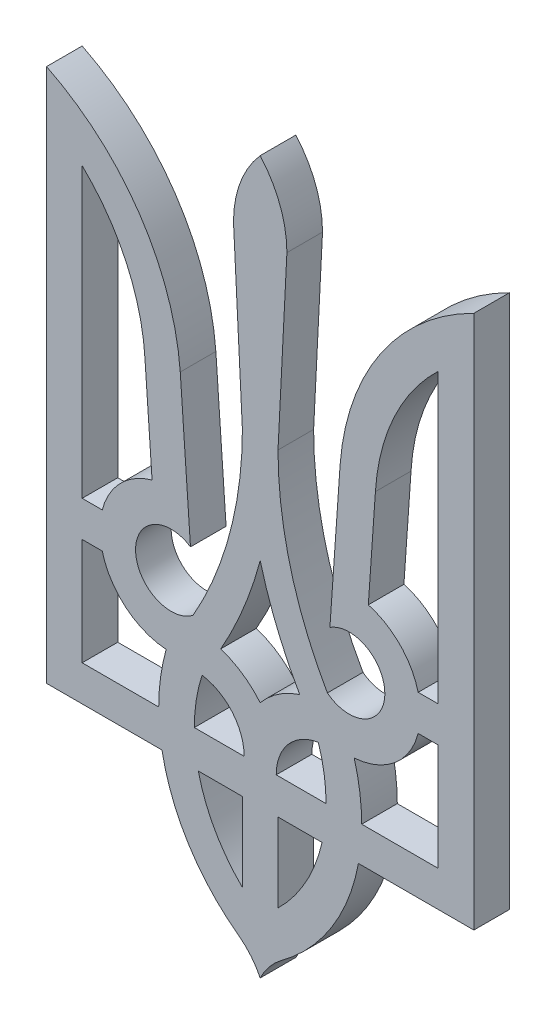
from build123d import *

# Parameters (mm, degrees)
EXTRUDE_1_DEPTH = 10
SCALE_1_SCALE   = 0.2


with BuildPart() as part:
    # Эскиз1 → Бобышка-Вытянуть1 (new body)
    with BuildSketch(Plane.XY):
        with BuildLine():
            Line((-60, -45), (-27.583269132, -45))
            ThreePointArc((-27.583269132, -45), (-20.06001769, -64.277376125), (-5.945767968, -79.41027067))
            ThreePointArc((-5.945767968, -79.41027067), (-2.542345747, -82.680315027), (0, -86.656865167))
            Line((0, -86.656865167), (0, -19.711115149))
            ThreePointArc((0, -19.711115149), (-5.008387109, -15.151161707), (-11.091351129, -12.172124017))
            ThreePointArc((-11.091351129, -12.172124017), (-4.677676581, 0.965070873), (0, 14.815718966))
            Line((0, 14.815718966), (0, 113.343134833))
            ThreePointArc((0, 113.343134833), (-5.562430401, 104.106601718), (-7.5, 93.5))
            Line((-7.5, 93.5), (-5, 44.25))
            ThreePointArc((-5, 44.25), (-8.525159088, 17.271181236), (-18.863936417, -7.896120801))
            ThreePointArc((-18.863936417, -7.896120801), (-34.990467135, -0.436539144), (-19.576058944, 8.401241779))
            Line((-19.576058944, 8.401241779), (-22.449472465, 49.49296956))
            ThreePointArc((-22.449472465, 49.49296956), (-33.881518529, 82.214174393), (-60, 105))
            Line((-60, 105), (-60, -45))
        make_face()
        with BuildLine():
            ThreePointArc((-26.401072965, -19.950864506), (-27.972740949, -27.40259956), (-28.5, -35))
            Line((-28.5, -35), (-50, -35))
            Line((-50, -35), (-50, -5))
            Line((-50, -5), (-44.364916731, -5))
            ThreePointArc((-44.364916731, -5), (-37.794087282, -15.372421104), (-26.401072965, -19.950864506))
        make_face(mode=Mode.SUBTRACT)
        with BuildLine():
            Line((-5, -45), (-5, -67.136427928))
            ThreePointArc((-5, -67.136427928), (-12.779082294, -56.957998409), (-17.374821937, -45))
            Line((-17.374821937, -45), (-5, -45))
        make_face(mode=Mode.SUBTRACT)
        with BuildLine():
            Line((-4.5, -35), (-18.5, -35))
            ThreePointArc((-18.5, -35), (-17.952221542, -28), (-16.322222222, -21.170419965))
            ThreePointArc((-16.322222222, -21.170419965), (-7.858362699, -25.902991945), (-4.5, -35))
        make_face(mode=Mode.SUBTRACT)
        with BuildLine():
            Line((-44.364916731, 5), (-50, 5))
            Line((-50, 5), (-50, 85.909197079))
            ThreePointArc((-50, 85.909197079), (-37.591425702, 68.515820434), (-32.355603325, 47.801370616))
            Line((-32.355603325, 47.801370616), (-30.360374841, 19.268273964))
            ThreePointArc((-30.360374841, 19.268273964), (-39.273434111, 14.009606657), (-44.364916731, 5))
        make_face(mode=Mode.SUBTRACT)
    extrude_1 = extrude(amount=EXTRUDE_1_DEPTH)

    # Зеркальное отражение1: Бобышка-Вытянуть1 across plane
    add(extrude_1.mirror(Plane(origin=(0, 0, 0), x_dir=(0, 0, 1), z_dir=(1, 0, 0))))


with BuildPart() as part_1:
    # Масштаб1: scaled about (0, 12.329369983, 5)
    add(part.part.scale(SCALE_1_SCALE).moved(Location((0, 9.863495986, 4))))


solid = part_1.part
